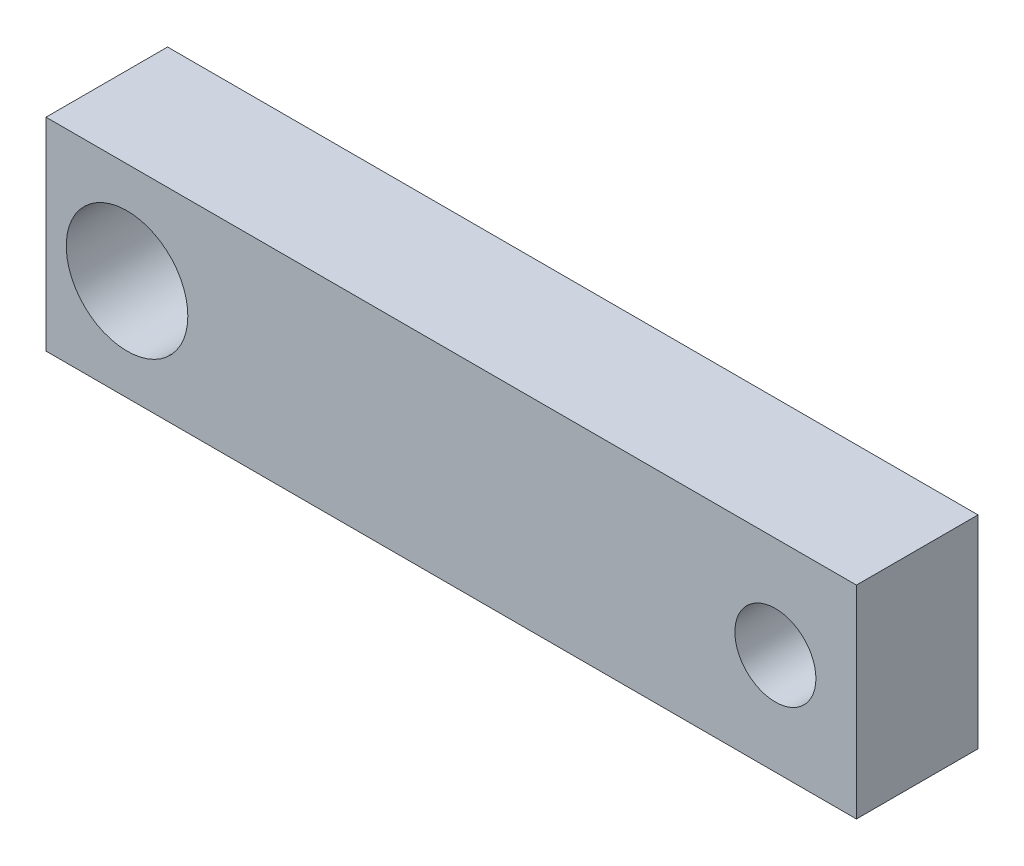
from build123d import *

# Parameters (mm, degrees)
SKETCH1_W           = 20
SKETCH1_H           = 5
SKETCH1_R           = 1
SKETCH1_R_2         = 1.5
BOSS_EXTRUDE1_DEPTH = 3


with BuildPart() as part:
    # Sketch1 → Boss-Extrude1 (new body)
    with BuildSketch(Plane.XY):
        Rectangle(SKETCH1_W, SKETCH1_H)
        with Locations((8, 0)):
            Circle(SKETCH1_R, mode=Mode.SUBTRACT)
        with Locations((-8, 0)):
            Circle(SKETCH1_R_2, mode=Mode.SUBTRACT)
    extrude(amount=BOSS_EXTRUDE1_DEPTH)


solid = part.part
